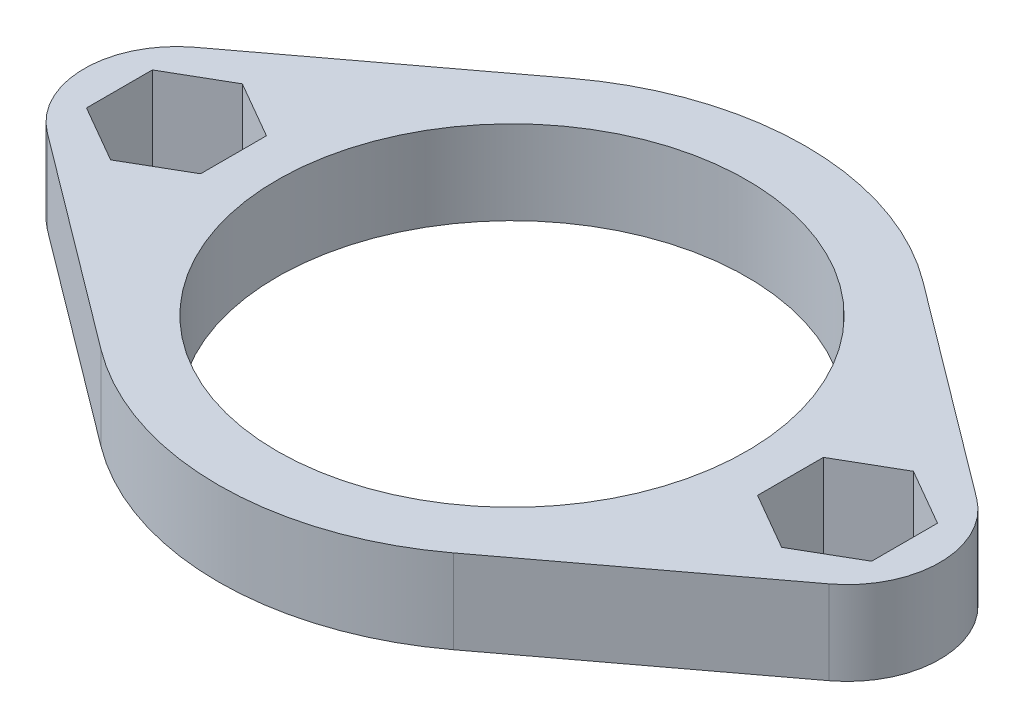
from build123d import *

# Parameters (mm, degrees)
SKETCH1_R           = 14
BOSS_EXTRUDE1_DEPTH = 5


with BuildPart() as part:
    # Sketch1 → Boss-Extrude1 (new body)
    with BuildSketch(Plane(origin=(0, 0, 0), x_dir=(1, 0, 0), z_dir=(0, 1, 0))):
        with BuildLine():
            Line((-23.3, 4.4), (-10.5, 14))
            ThreePointArc((-10.5, 14), (0, 17.5), (10.5, 14))
            Line((10.5, 14), (23.3, 4.4))
            ThreePointArc((23.3, 4.4), (25.5, 0), (23.3, -4.4))
            Line((23.3, -4.4), (10.5, -14))
            ThreePointArc((10.5, -14), (0, -17.5), (-10.5, -14))
            Line((-10.5, -14), (-23.3, -4.4))
            ThreePointArc((-23.3, -4.4), (-25.5, 0), (-23.3, 4.4))
        make_face()
        with Locations(Location((0, 0, 0), (0, 0, 270))):
            Circle(SKETCH1_R, mode=Mode.SUBTRACT)
        Polygon((-20, 3.92598183), (-23.4, 1.962990915), (-23.4, -1.962990915), (-20, -3.92598183), (-16.6, -1.962990915), (-16.6, 1.962990915), align=None, mode=Mode.SUBTRACT)
        Polygon((20, -3.92598183), (23.4, -1.962990915), (23.4, 1.962990915), (20, 3.92598183), (16.6, 1.962990915), (16.6, -1.962990915), align=None, mode=Mode.SUBTRACT)
    extrude(amount=BOSS_EXTRUDE1_DEPTH)


solid = part.part
